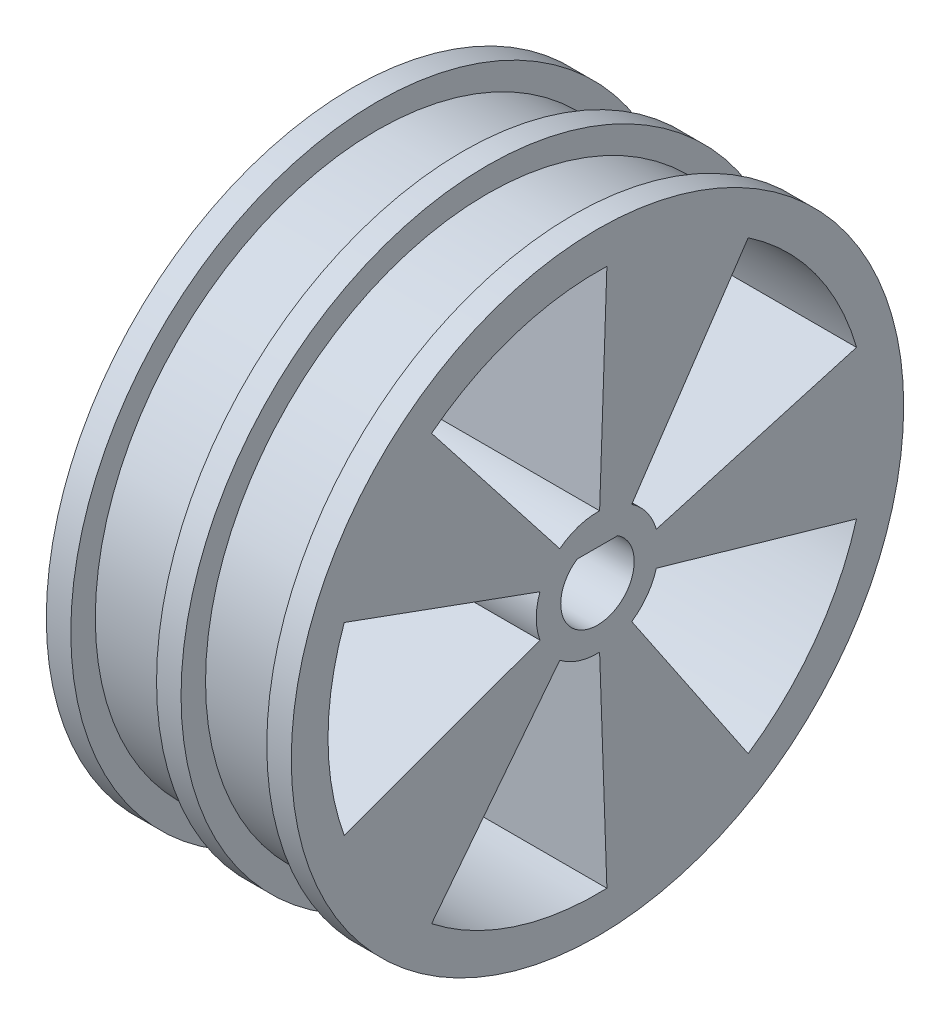
from build123d import *

# Parameters (mm, degrees)
BASE_DEPTH          = 10
BASE_DEPTH_BACK     = 10
ESQUISSE1_R         = 25
ESQUISSE2_R         = 25
ESQUISSE2_R_2       = 23
VIDE_GORGE_DEPTH    = 7
VIDE_JANTE_DEPTH    = 20
ESQUISSE6_R         = 3
VIDE_BLOC_AXE_DEPTH = 4


with BuildPart() as part:
    # Esquisse1 → BASE (new, two sides: drawn at the far end of the back side and taken through both)
    with BuildSketch(Plane(origin=(0, 0, 0), x_dir=(0, 0, -1), z_dir=(1, 0, 0)).offset(-BASE_DEPTH_BACK)):
        Circle(ESQUISSE1_R)
        with BuildLine():
            Line((-1.658312395, 2.5), (1.658312395, 2.5))
            ThreePointArc((1.658312395, 2.5), (0, -3), (-1.658312395, 2.5))
        make_face(mode=Mode.SUBTRACT)
    extrude(amount=BASE_DEPTH + BASE_DEPTH_BACK)

    # Esquisse2 → VIDE GORGE (cut)
    with BuildSketch(Plane.ZY.offset(8)):
        with Locations(Location((0, 0, 0), (0, 0, 180))):
            Circle(ESQUISSE2_R)
        Circle(ESQUISSE2_R_2, mode=Mode.SUBTRACT)
    vide_gorge = extrude(amount=-VIDE_GORGE_DEPTH, mode=Mode.SUBTRACT)

    # SYM GORGE: VIDE GORGE across plane
    add(vide_gorge.mirror(Plane(origin=(0, 0, 0), x_dir=(0, 0, 1), z_dir=(1, 0, 0))), mode=Mode.SUBTRACT)

    # Esquisse4 → VIDE JANTE (cut)
    with BuildSketch(Plane(origin=(10, 0, 0), x_dir=(0, 0, -1), z_dir=(1, 0, 0))):
        with BuildLine():
            Line((-22, 0), (-5, 0))
            ThreePointArc((-5, 0), (-4.924038765, 0.868240888), (-4.698463104, 1.710100717))
            Line((-4.698463104, 1.710100717), (-20.673237657, 7.524443153))
            ThreePointArc((-20.673237657, 7.524443153), (-21.665770566, 3.820259909), (-22, 0))
        make_face()
        with BuildLine():
            ThreePointArc((-4.698463104, -1.710100717), (-4.924038765, -0.868240888), (-5, 0))
            Line((-5, 0), (-22, 0))
            ThreePointArc((-22, 0), (-21.665770566, -3.820259909), (-20.673237657, -7.524443153))
            Line((-20.673237657, -7.524443153), (-4.698463104, -1.710100717))
        make_face()
        with BuildLine():
            Line((-13.544552457, 17.336236579), (-3.078307377, 3.940053768))
            ThreePointArc((-3.078307377, 3.940053768), (-1.545084972, 4.755282581), (0.174497484, 4.996954135))
            Line((0.174497484, 4.996954135), (0.767788927, 21.986598194))
            ThreePointArc((0.767788927, 21.986598194), (-6.798373876, 20.923243358), (-13.544552457, 17.336236579))
        make_face()
        with BuildLine():
            Line((12.302243876, 18.238826596), (2.795964517, 4.145187863))
            ThreePointArc((2.795964517, 4.145187863), (4.045084972, 2.938926261), (4.80630848, 1.378186779))
            Line((4.80630848, 1.378186779), (21.147757311, 6.064021828))
            ThreePointArc((21.147757311, 6.064021828), (17.798373876, 12.93127555), (12.302243876, 18.238826596))
        make_face()
        with BuildLine():
            ThreePointArc((4.80630848, -1.378186779), (4.045084972, -2.938926261), (2.795964517, -4.145187863))
            Line((2.795964517, -4.145187863), (12.302243876, -18.238826596))
            ThreePointArc((12.302243876, -18.238826596), (17.798373876, -12.93127555), (21.147757311, -6.064021828))
            Line((21.147757311, -6.064021828), (4.80630848, -1.378186779))
        make_face()
        with BuildLine():
            ThreePointArc((0.174497484, -4.996954135), (-1.545084972, -4.755282581), (-3.078307377, -3.940053768))
            Line((-3.078307377, -3.940053768), (-13.544552457, -17.336236579))
            ThreePointArc((-13.544552457, -17.336236579), (-6.798373876, -20.923243358), (0.767788927, -21.986598194))
            Line((0.767788927, -21.986598194), (0.174497484, -4.996954135))
        make_face()
    extrude(amount=-VIDE_JANTE_DEPTH, mode=Mode.SUBTRACT)

    # Esquisse6 → VIDE BLOC AXE (cut)
    with BuildSketch(Plane.ZY.offset(10)):
        with Locations(Location((0, 0, 0), (0, 0, 180))):
            Circle(ESQUISSE6_R)
    extrude(amount=-VIDE_BLOC_AXE_DEPTH, mode=Mode.SUBTRACT)


solid = part.part
